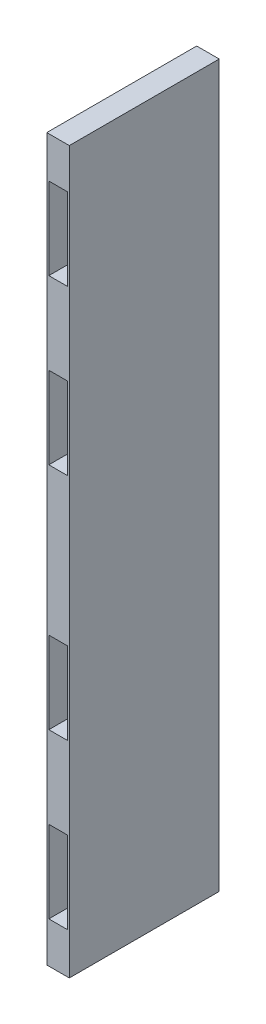
from build123d import *

# Parameters (mm, degrees)
PROFILE_SKETCH_W          = 2.5
PROFILE_SKETCH_H          = 18.3
PROFILE_EXTRUDE_DEPTH     = 88
COVER_LATCH_CUT_OUT_DEPTH = 2.25
SIDE_SKETCH_W             = 0.25
SIDE_SKETCH_H             = 18.3
SIDE_EXTRUDE_DEPTH        = 88


with BuildPart() as part:
    # Profile Sketch → Profile Extrude (new body)
    with BuildSketch(Plane(origin=(0.045617437, 0, -0.024209872), x_dir=(-1, 0, 0), z_dir=(0, 1, 0))):
        with Locations((1.295617437, -9.125790128)):
            Rectangle(PROFILE_SKETCH_W, PROFILE_SKETCH_H)
    extrude(amount=PROFILE_EXTRUDE_DEPTH)

    # Cover Latch Cut Out Sketch → Cover Latch Cut Out (cut)
    with BuildSketch(Plane.ZY.offset(2.5)):
        Polygon((-18.3, 27), (-18.3, 13), (-8.858262488, 13), (-8.858262488, 5), (0, 5), (0, 15), (-2.2, 15), (-2.858262488, 20), (-2.2, 25), (0, 25), (0, 35), (-8.858262488, 35), (-8.858262488, 27), align=None)
    cover_latch_cut_out = extrude(amount=-COVER_LATCH_CUT_OUT_DEPTH, mode=Mode.SUBTRACT)

    # Cover Latch Cut Out Mirror: Cover Latch Cut Out across plane
    add(cover_latch_cut_out.mirror(Plane(origin=(0, 44, 0), x_dir=(0, 0, 1), z_dir=(0, -1, 0))), mode=Mode.SUBTRACT)

    # Side Sketch → Side Extrude (add, through all)
    with BuildSketch(Plane(origin=(0, 0, 0), x_dir=(1, 0, 0), z_dir=(0, 1, 0))):
        with Locations((-2.625, 9.15)):
            Rectangle(SIDE_SKETCH_W, SIDE_SKETCH_H)
    extrude(amount=SIDE_EXTRUDE_DEPTH)


solid = part.part
